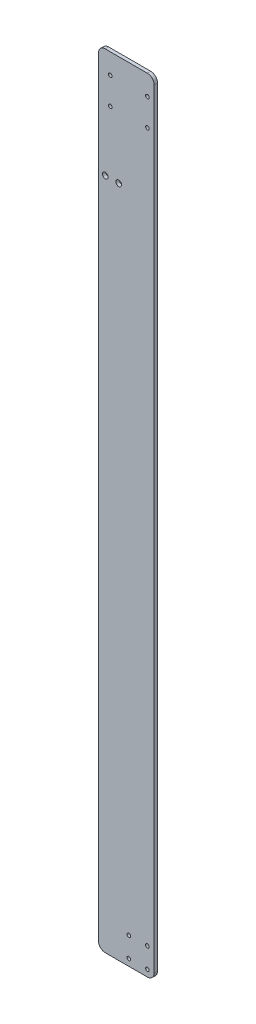
from build123d import *

# Parameters (mm, degrees)
SKETCH1_R           = 3.429
SKETCH1_R_2         = 5.3578125
BOSS_EXTRUDE1_DEPTH = 6.35


with BuildPart() as part:
    # Sketch1 → Boss-Extrude1 (new body)
    with BuildSketch(Plane.XY):
        with BuildLine():
            Line((12.7, 0), (92.075, 0))
            ThreePointArc((92.075, 0), (101.055256121, 3.719743879), (104.775, 12.7))
            Line((104.775, 12.7), (104.775, 1460.5))
            ThreePointArc((104.775, 1460.5), (101.055256121, 1469.480256121), (92.075, 1473.2))
            Line((92.075, 1473.2), (12.7, 1473.2))
            ThreePointArc((12.7, 1473.2), (3.719743879, 1469.480256121), (0, 1460.5))
            Line((0, 1460.5), (0, 12.7))
            ThreePointArc((0, 12.7), (3.719743879, 3.719743879), (12.7, 0))
        make_face()
        with Locations((92.075, 1435.1)):
            Circle(SKETCH1_R, mode=Mode.SUBTRACT)
        with Locations((92.075, 1384.3)):
            Circle(SKETCH1_R, mode=Mode.SUBTRACT)
        with Locations((22.225, 1384.3)):
            Circle(SKETCH1_R, mode=Mode.SUBTRACT)
        with Locations((22.225, 1435.1)):
            Circle(SKETCH1_R, mode=Mode.SUBTRACT)
        with Locations((92.075, 50.8)):
            Circle(SKETCH1_R, mode=Mode.SUBTRACT)
        with Locations((57.15, 50.8)):
            Circle(SKETCH1_R, mode=Mode.SUBTRACT)
        with Locations((57.15, 12.7)):
            Circle(SKETCH1_R, mode=Mode.SUBTRACT)
        with Locations((92.075, 12.7)):
            Circle(SKETCH1_R, mode=Mode.SUBTRACT)
        with Locations((38.1, 1266.825)):
            Circle(SKETCH1_R_2, mode=Mode.SUBTRACT)
        with Locations((12.7, 1266.825)):
            Circle(SKETCH1_R_2, mode=Mode.SUBTRACT)
    extrude(amount=BOSS_EXTRUDE1_DEPTH)


solid = part.part
